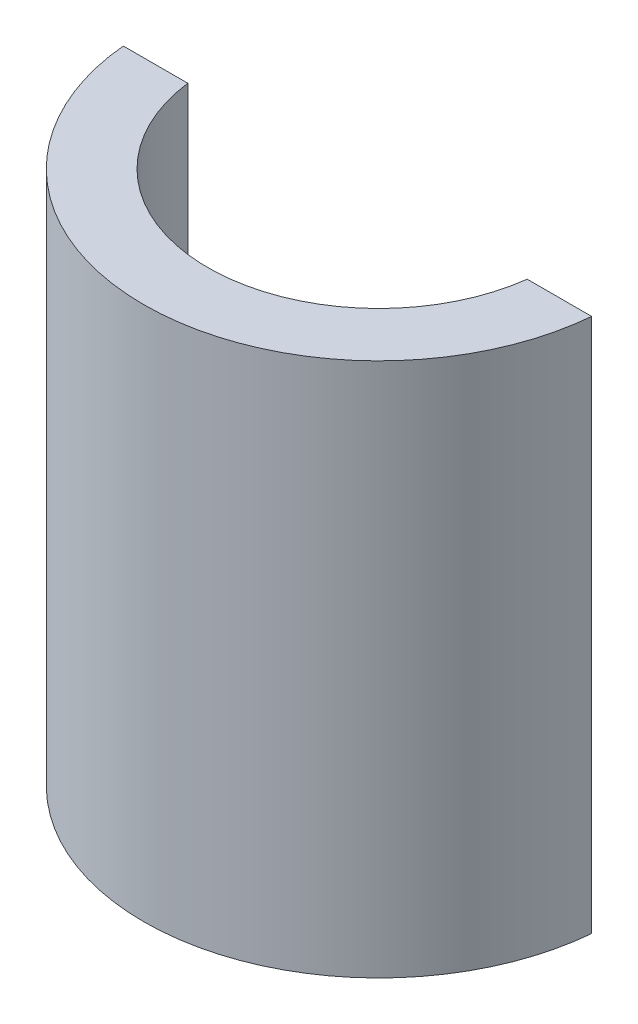
from build123d import *

# Parameters (mm, degrees)
BOSS_EXTRUDE1_DEPTH = 25


with BuildPart() as part:
    # Sketch1 → Boss-Extrude1 (new body)
    with BuildSketch(Plane(origin=(0, 0, 0), x_dir=(1, 0, 0), z_dir=(0, 1, 0))):
        with BuildLine():
            Line((-10.95445115, -1), (-7.937253933, -1))
            ThreePointArc((-7.937253933, -1), (0, -8), (7.937253933, -1))
            Line((7.937253933, -1), (10.95445115, -1))
            ThreePointArc((10.95445115, -1), (0, -11), (-10.95445115, -1))
        make_face()
    extrude(amount=BOSS_EXTRUDE1_DEPTH)


solid = part.part
